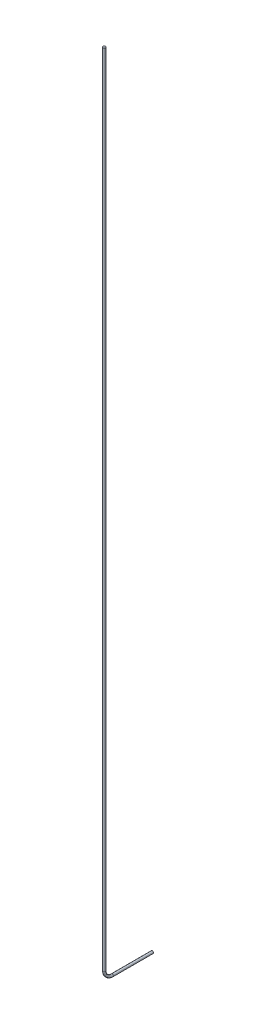
from build123d import *

# Parameters (mm, degrees)
SKETCH_1_R      = 0.75
EXTRUDE_1_DEPTH = 20
SKETCH_2_R      = 0.75


with BuildPart() as part:
    # ｽｹｯﾁ1 → ﾎﾞｽ - 押し出し1 (new body)
    with BuildSketch(Plane.XY):
        Circle(SKETCH_1_R)
    extrude(amount=EXTRUDE_1_DEPTH)

    # ｽｲｰﾌﾟ1: sweep along a path in ｽｹｯﾁ3
    with BuildLine(Plane(origin=(0, 0, 0), x_dir=(0, 0, -1), z_dir=(1, 0, 0))) as sweep_1_path:
        Line((-20, 0), (-25, 0))
        ThreePointArc((-25, 0), (-28.535533906, 1.464466094), (-30, 5))
        Line((-30, 5), (-30, 505))
    # ｽｹｯﾁ2 → ｽｲｰﾌﾟ1 (sweep)
    with BuildSketch(Plane.XY.offset(20)):
        Circle(SKETCH_2_R)
    sweep(path=sweep_1_path.line)


solid = part.part
